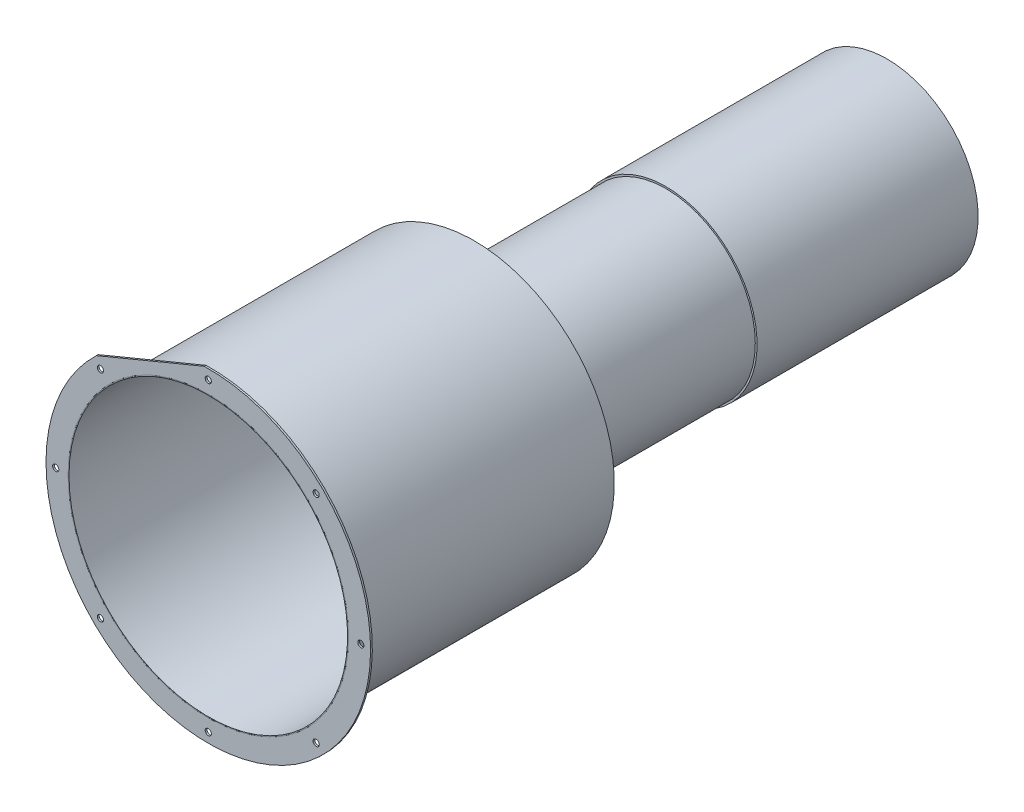
from build123d import *

# Parameters (mm, degrees)
EXTRUDE_THIN1_START = -250
SKETCH2_R           = 103
SKETCH2_R_2         = 101
EXTRUDE_THIN1_DEPTH = 250
SKETCH3_R           = 183.5
SKETCH3_R_2         = 158.5
EXTRUDE1_DEPTH      = 2
SKETCH4_R           = 3.5
EXTRUDE2_DEPTH      = 2
CIRPATTERN1_COUNT   = 8
EXTRUDE3_DEPTH      = 10


with BuildPart() as part:
    # Sketch1 → Revolve-Thin1 (revolve)
    with BuildSketch(Plane(origin=(0, 0, 0), x_dir=(0, 0, -1), z_dir=(1, 0, 0)), mode=Mode.PRIVATE) as revolve_thin1_sk:
        Polygon((-767.5, 157.5), (-467.5, 157.5), (-434.302359522, 100), (0, 100), (0, 101), (-433.725009252, 101), (-466.922649731, 158.5), (-767.5, 158.5), align=None)
    revolve(revolve_thin1_sk.sketch.rotate(Axis((0, 0, 0), (0, 0, 1)), 90), axis=Axis((0, 0, 0), (0, 0, 1)))

    # Sketch2 → Extrude-Thin1 (add)
    with BuildSketch(Plane(origin=(0, 0, 0), x_dir=(-1, 0, 0), z_dir=(0, 0, -1)).offset(EXTRUDE_THIN1_START)):
        Circle(SKETCH2_R)
        Circle(SKETCH2_R_2, mode=Mode.SUBTRACT)
    extrude(amount=EXTRUDE_THIN1_DEPTH)


with BuildPart() as body_2:
    # Sketch3 → Extrude1 (new body)
    with BuildSketch(Plane.XY.offset(767.5)):
        Circle(SKETCH3_R)
        Circle(SKETCH3_R_2, mode=Mode.SUBTRACT)
    extrude(amount=-EXTRUDE1_DEPTH)

    # Sketch4 → Extrude2 (cut)
    with BuildSketch(Plane.XY.offset(767.5)):
        with Locations((172.5, 0)):
            Circle(SKETCH4_R)
    extrude2 = extrude(amount=-EXTRUDE2_DEPTH, mode=Mode.SUBTRACT)

    # CirPattern1: Extrude2 ×8 about axis
    cirpattern1_axis = Axis((0, 0, 0), (0, 0, 1))
    for i in range(1, CIRPATTERN1_COUNT):
        add(extrude2.rotate(cirpattern1_axis, i * 360 / CIRPATTERN1_COUNT), mode=Mode.SUBTRACT)

    # Sketch5 → Extrude3 (cut)
    with BuildSketch(Plane(origin=(0, 0, 765.5), x_dir=(-1, 0, 0), z_dir=(0, 0, -1))):
        with BuildLine():
            Line((4.53315254, 183.443998343), (126.509072295, 132.919918098))
            ThreePointArc((126.509072295, 132.919918098), (70.222409839, 169.531894216), (4.53315254, 183.443998343))
        make_face()
    extrude(amount=-EXTRUDE3_DEPTH, mode=Mode.SUBTRACT)


solid = Compound([part.part, body_2.part])
